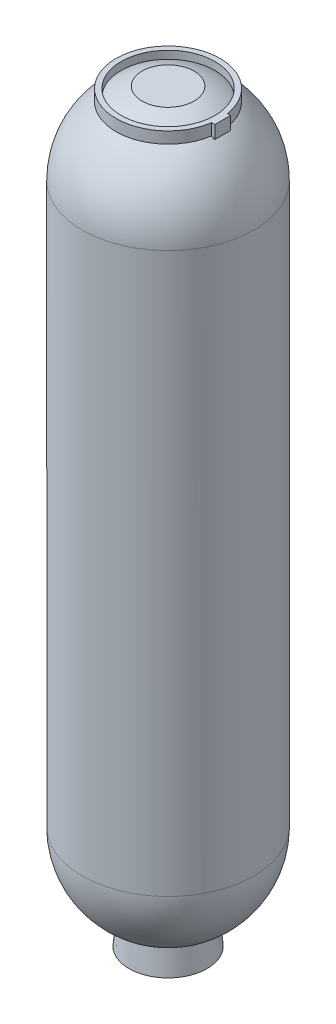
from build123d import *

# Parameters (mm, degrees)
SKETCH_2_W        = 3
SKETCH_2_H        = 6
EXTRUDE_660_DEPTH = 5


with BuildPart() as part:
    # Sketch 202 → Revolve 495 (revolve)
    with BuildSketch(Plane.XY, mode=Mode.PRIVATE) as revolve_495_sk:
        with BuildLine():
            Line((15, 0), (13, 0))
            Line((13, 0), (6, 10))
            Line((6, 10), (0, 10))
            Line((0, 10), (0, 286.3))
            Line((0, 286.3), (10, 286.3))
            ThreePointArc((10, 286.3), (14.127651137, 284.674598502), (18, 282.510262985))
            Line((18, 282.510262985), (18, 285.510262985))
            Line((18, 285.510262985), (20, 285.510262985))
            Line((20, 285.510262985), (20, 281.10043911))
            ThreePointArc((20, 281.10043911), (29.571946165, 269.497448129), (33, 254.851629613))
            Line((33, 254.851629613), (33, 39.851629613))
            ThreePointArc((33, 39.851629613), (27.867639585, 22.176939688), (14.066990064, 10))
            Line((14.066990064, 10), (15, 0))
        make_face()
    revolve(revolve_495_sk.sketch.rotate(Axis((0, 0, 0), (0, 1, 0)), 90), axis=Axis((0, 0, 0), (0, 1, 0)))

    # Эскиз2 → Extrude 660 (add)
    with BuildSketch(Plane(origin=(0, 285.510262985, 0), x_dir=(1, 0, 0), z_dir=(0, 1, 0))):
        with Locations((19.5, 0)):
            Rectangle(SKETCH_2_W, SKETCH_2_H)
    extrude(amount=-EXTRUDE_660_DEPTH)


solid = part.part
